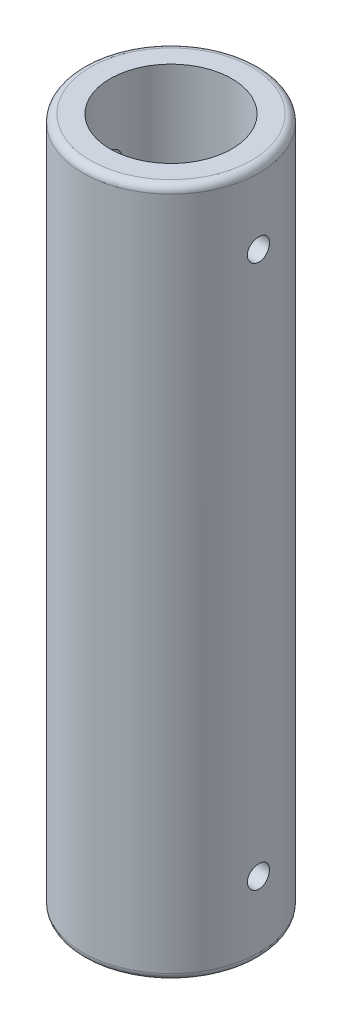
from build123d import *

# Parameters (mm, degrees)
SKETCH1_W               = 1.85
SKETCH1_H               = 47
CUT_EXTRUDE1_DEPTH      = 25.984995497
CUT_EXTRUDE1_DEPTH_BACK = 25.984995497
SKETCH2_R               = 0.75
FILLET1_R               = 0.5


with BuildPart() as part:
    # Sketch1 → Revolve1 (revolve)
    with BuildSketch(Plane(origin=(0, 0, 0), x_dir=(0, 0, -1), z_dir=(1, 0, 0)), mode=Mode.PRIVATE) as revolve1_sk:
        with Locations((5.075, 0)):
            Rectangle(SKETCH1_W, SKETCH1_H)
    revolve(revolve1_sk.sketch.rotate(Axis((0, 43.756475867, 0), (0, -1, 0)), 180), axis=Axis((0, 43.756475867, 0), (0, -1, 0)))

    # Sketch2 → Cut-Extrude1 (cut, two sides: drawn at the far end of the back side and taken through both)
    with BuildSketch(Plane(origin=(0, 0, 0), x_dir=(0, 0, -1), z_dir=(1, 0, 0)).offset(-CUT_EXTRUDE1_DEPTH_BACK)):
        with Locations((0, 18.5)):
            Circle(SKETCH2_R)
        with Locations((0, -18.5)):
            Circle(SKETCH2_R)
    extrude(amount=CUT_EXTRUDE1_DEPTH + CUT_EXTRUDE1_DEPTH_BACK, mode=Mode.SUBTRACT)

    # Fillet1
    fillet1_edges = [part.edges().sort_by_distance(p)[0] for p in [
        (0, -23.5, -6),
        (0, 23.5, -6),
    ]]
    fillet(fillet1_edges, radius=FILLET1_R)


solid = part.part
